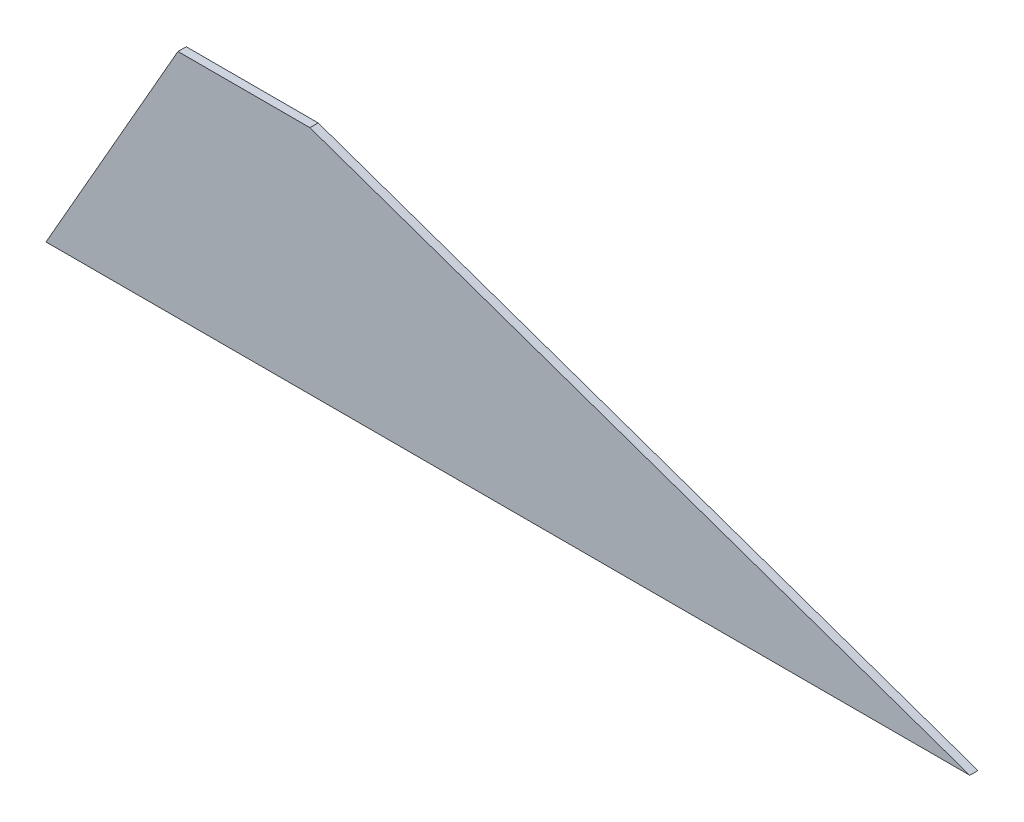
from build123d import *

# Parameters (mm, degrees)
BOSS_EXTRUDE1_DEPTH = 3.175


with BuildPart() as part:
    # Sketch1 → Boss-Extrude1 (new body)
    with BuildSketch(Plane.XY):
        Polygon((0, 0), (-355.6, 0), (-304.8, 88.9), (-254, 88.9), align=None)
    extrude(amount=BOSS_EXTRUDE1_DEPTH)


solid = part.part
